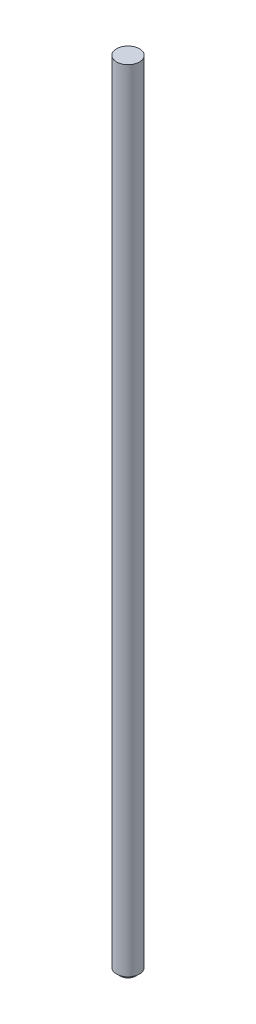
from build123d import *


with BuildPart() as part:
    # Sketch1 → Revolve1 (revolve)
    with BuildSketch(Plane.XY, mode=Mode.PRIVATE) as revolve1_sk:
        Polygon((5.775, 1.751977143), (4, 1.751977143), (4, 0), (0, 0), (0, 400), (5.775, 400), align=None)
    revolve(revolve1_sk.sketch.rotate(Axis((0, 0, 0), (0, 1, 0)), 90), axis=Axis((0, 0, 0), (0, 1, 0)))


solid = part.part
